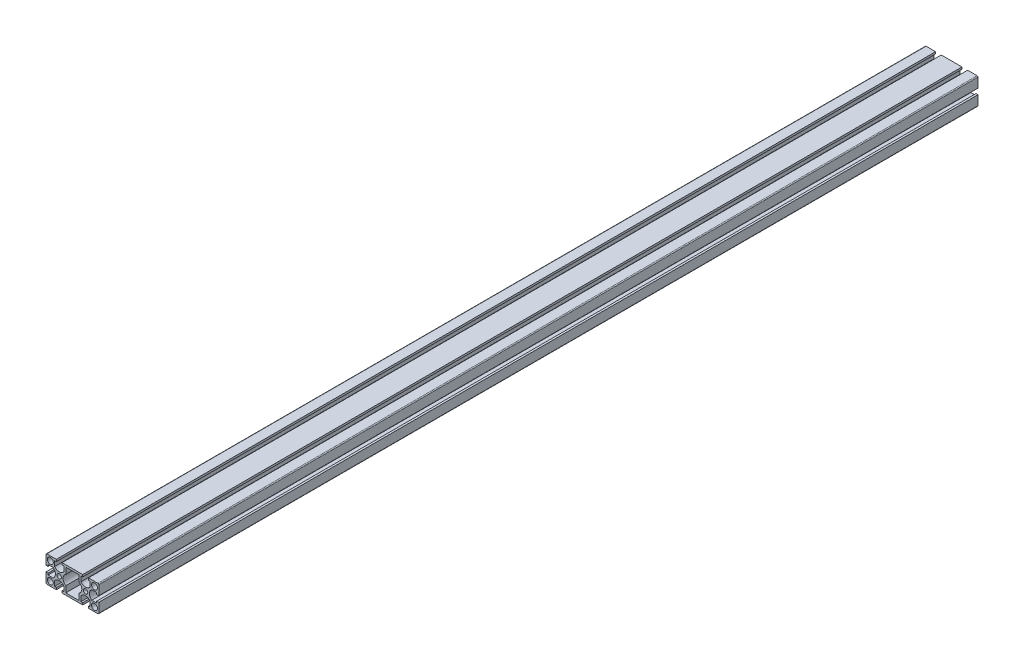
from build123d import *

# Parameters (mm, degrees)
SKETCH_1_R      = 2.5
SKETCH_1_R_2    = 3.4
EXTRUDE_1_DEPTH = 1000


with BuildPart() as part:
    # 草图1 → 凸台-拉伸1 (new body)
    with BuildSketch(Plane.XY):
        with BuildLine():
            Line((-17.204286219, -18.118225585), (6.295713781, -18.118225585))
            Line((6.295713781, -18.118225585), (6.295713781, -15.818225585))
            Line((6.295713781, -15.818225585), (4.345713781, -15.818225585))
            Line((4.345713781, -15.818225585), (4.345713781, -10.018225585))
            ThreePointArc((4.345713781, -10.018225585), (9.545713781, -7.418225585), (14.745713781, -10.018225585))
            Line((14.745713781, -10.018225585), (14.745713781, -15.818225585))
            Line((14.745713781, -15.818225585), (12.795713781, -15.818225585))
            Line((12.795713781, -15.818225585), (12.795713781, -18.118225585))
            Line((12.795713781, -18.118225585), (23.545713781, -18.118225585))
            ThreePointArc((23.545713781, -18.118225585), (24.252820562, -17.825332366), (24.545713781, -17.118225585))
            Line((24.545713781, -17.118225585), (24.545713781, -6.368225585))
            Line((24.545713781, -6.368225585), (22.245713781, -6.368225585))
            Line((22.245713781, -6.368225585), (22.245713781, -8.318225585))
            Line((22.245713781, -8.318225585), (16.445713781, -8.318225585))
            ThreePointArc((16.445713781, -8.318225585), (13.845713781, -3.118225585), (16.445713781, 2.081774415))
            Line((16.445713781, 2.081774415), (22.245713781, 2.081774415))
            Line((22.245713781, 2.081774415), (22.245713781, 0.131774415))
            Line((22.245713781, 0.131774415), (24.545713781, 0.131774415))
            Line((24.545713781, 0.131774415), (24.545713781, 10.881774415))
            ThreePointArc((24.545713781, 10.881774415), (24.252820562, 11.588881197), (23.545713781, 11.881774415))
            Line((23.545713781, 11.881774415), (12.795713781, 11.881774415))
            Line((12.795713781, 11.881774415), (12.795713781, 9.581774415))
            Line((12.795713781, 9.581774415), (14.745713781, 9.581774415))
            Line((14.745713781, 9.581774415), (14.745713781, 3.781774415))
            ThreePointArc((14.745713781, 3.781774415), (9.545713781, 1.181774415), (4.345713781, 3.781774415))
            Line((4.345713781, 3.781774415), (4.345713781, 9.581774415))
            Line((4.345713781, 9.581774415), (6.295713781, 9.581774415))
            Line((6.295713781, 9.581774415), (6.295713781, 11.881774415))
            Line((6.295713781, 11.881774415), (-17.204286219, 11.881774415))
            Line((-17.204286219, 11.881774415), (-17.204286219, 9.581774415))
            Line((-17.204286219, 9.581774415), (-15.254286219, 9.581774415))
            Line((-15.254286219, 9.581774415), (-15.254286219, 3.781774415))
            ThreePointArc((-15.254286219, 3.781774415), (-20.454286219, 1.181774415), (-25.654286219, 3.781774415))
            Line((-25.654286219, 3.781774415), (-25.654286219, 9.581774415))
            Line((-25.654286219, 9.581774415), (-23.704286219, 9.581774415))
            Line((-23.704286219, 9.581774415), (-23.704286219, 11.881774415))
            Line((-23.704286219, 11.881774415), (-34.454286219, 11.881774415))
            ThreePointArc((-34.454286219, 11.881774415), (-35.161393, 11.588881197), (-35.454286219, 10.881774415))
            Line((-35.454286219, 10.881774415), (-35.454286219, 0.131774415))
            Line((-35.454286219, 0.131774415), (-33.154286219, 0.131774415))
            Line((-33.154286219, 0.131774415), (-33.154286219, 2.081774415))
            Line((-33.154286219, 2.081774415), (-27.354286219, 2.081774415))
            ThreePointArc((-27.354286219, 2.081774415), (-24.754286219, -3.118225585), (-27.354286219, -8.318225585))
            Line((-27.354286219, -8.318225585), (-33.154286219, -8.318225585))
            Line((-33.154286219, -8.318225585), (-33.154286219, -6.368225585))
            Line((-33.154286219, -6.368225585), (-35.454286219, -6.368225585))
            Line((-35.454286219, -6.368225585), (-35.454286219, -17.118225585))
            ThreePointArc((-35.454286219, -17.118225585), (-35.161393, -17.825332366), (-34.454286219, -18.118225585))
            Line((-34.454286219, -18.118225585), (-23.704286219, -18.118225585))
            Line((-23.704286219, -18.118225585), (-23.704286219, -15.818225585))
            Line((-23.704286219, -15.818225585), (-25.654286219, -15.818225585))
            Line((-25.654286219, -15.818225585), (-25.654286219, -10.018225585))
            ThreePointArc((-25.654286219, -10.018225585), (-20.454286219, -7.418225585), (-15.254286219, -10.018225585))
            Line((-15.254286219, -10.018225585), (-15.254286219, -15.818225585))
            Line((-15.254286219, -15.818225585), (-17.204286219, -15.818225585))
            Line((-17.204286219, -15.818225585), (-17.204286219, -18.118225585))
        make_face()
        with Locations((-20.454286219, -3.118225585)):
            Circle(SKETCH_1_R, mode=Mode.SUBTRACT)
        with Locations((-30.554286219, -13.218225585)):
            Circle(SKETCH_1_R_2, mode=Mode.SUBTRACT)
        with Locations((-30.554286219, 6.981774415)):
            Circle(SKETCH_1_R_2, mode=Mode.SUBTRACT)
        with Locations((19.645713781, -13.218225585)):
            Circle(SKETCH_1_R_2, mode=Mode.SUBTRACT)
        with Locations((19.645713781, 6.981774415)):
            Circle(SKETCH_1_R_2, mode=Mode.SUBTRACT)
        with Locations((9.545713781, -3.118225585)):
            Circle(SKETCH_1_R, mode=Mode.SUBTRACT)
        with BuildLine():
            Line((2.045713781, -15.818225585), (2.045713781, -8.718225585))
            ThreePointArc((2.045713781, -8.718225585), (5.245713781, -3.118225585), (2.045713781, 2.481774415))
            Line((2.045713781, 2.481774415), (2.045713781, 9.581774415))
            Line((2.045713781, 9.581774415), (-12.954286219, 9.581774415))
            Line((-12.954286219, 9.581774415), (-12.954286219, 2.481774415))
            ThreePointArc((-12.954286219, 2.481774415), (-16.154286219, -3.118225585), (-12.954286219, -8.718225585))
            Line((-12.954286219, -8.718225585), (-12.954286219, -15.818225585))
            Line((-12.954286219, -15.818225585), (2.045713781, -15.818225585))
        make_face(mode=Mode.SUBTRACT)
    extrude(amount=EXTRUDE_1_DEPTH)


solid = part.part
